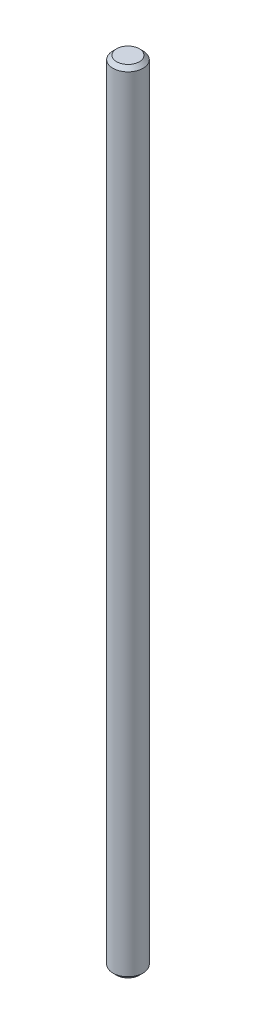
from build123d import *

# Parameters (mm, degrees)
SKETCH1_R           = 2
BOSS_EXTRUDE1_DEPTH = 52.5
CHAMFER1_SIZE       = 0.5


with BuildPart() as part:
    # Sketch1 → Boss-Extrude1 (new, symmetric)
    with BuildSketch(Plane(origin=(0, 0, 0), x_dir=(1, 0, 0), z_dir=(0, 1, 0))):
        with Locations(Location((0, 0, 0), (0, 0, 270))):
            Circle(SKETCH1_R)
    extrude(amount=BOSS_EXTRUDE1_DEPTH, both=True)

    # Chamfer1
    chamfer1_edges = [part.edges().sort_by_distance(p)[0] for p in [
        (0, -52.5, -2),
        (0, 52.5, -2),
    ]]
    chamfer(chamfer1_edges, length=CHAMFER1_SIZE)


solid = part.part
